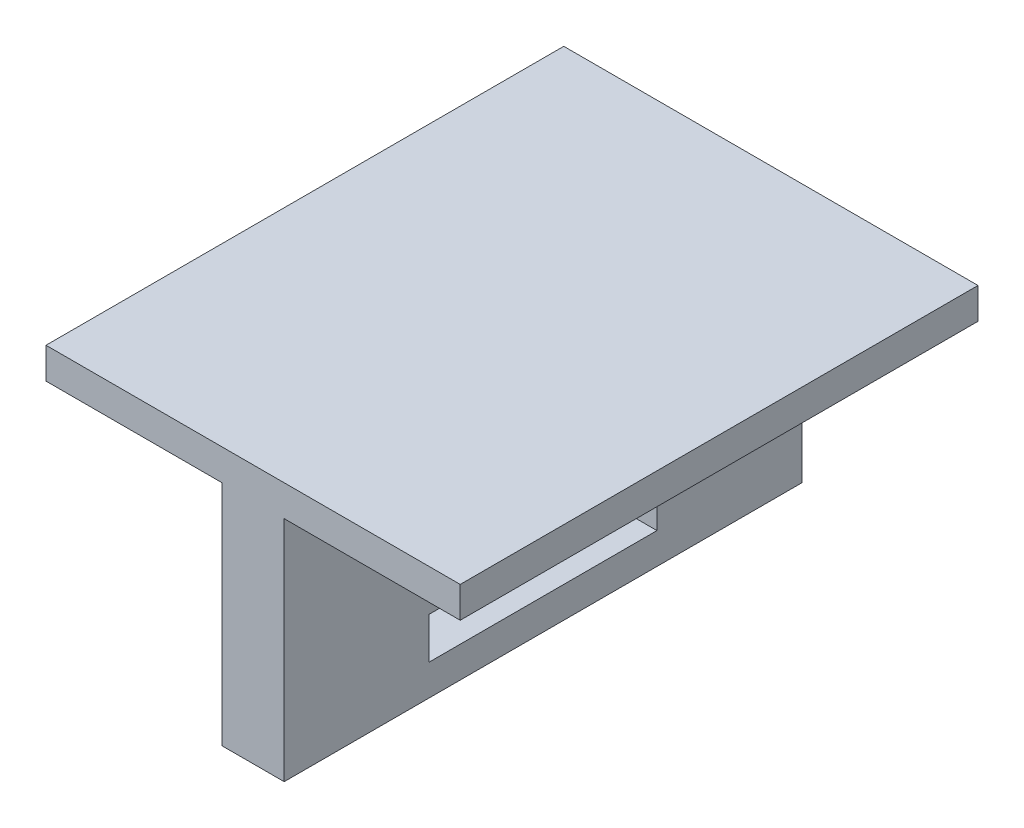
from build123d import *

# Parameters (mm, degrees)
BOSS_EXTRUDE2_DEPTH      = 3
BOSS_EXTRUDE2_DEPTH_BACK = 3
SKETCH2_W                = 50
SKETCH2_H                = 22
SKETCH2_W_2              = 22
SKETCH2_H_2              = 4
BOSS_EXTRUDE3_DEPTH      = 20
BOSS_EXTRUDE3_DEPTH_BACK = 20
SKETCH2_3_W              = 50
SKETCH2_3_H              = 3


with BuildPart() as part:
    # Sketch2 → Boss-Extrude2 (new, two sides: drawn at the far end of the back side and taken through both)
    with BuildSketch(Plane(origin=(0, 0, 0), x_dir=(0, 0, -1), z_dir=(1, 0, 0)).offset(-BOSS_EXTRUDE2_DEPTH_BACK)):
        with Locations((0, -1.5)):
            Rectangle(SKETCH2_W, SKETCH2_H)
        with Locations((0, -7.5)):
            Rectangle(SKETCH2_W_2, SKETCH2_H_2, mode=Mode.SUBTRACT)
    extrude(amount=BOSS_EXTRUDE2_DEPTH + BOSS_EXTRUDE2_DEPTH_BACK)

    # Sketch2<3> → Boss-Extrude3 (add, two sides: drawn at the far end of the back side and taken through both)
    with BuildSketch(Plane(origin=(0, 0, 0), x_dir=(0, 0, -1), z_dir=(1, 0, 0)).offset(-BOSS_EXTRUDE3_DEPTH_BACK)):
        with Locations((0, 11)):
            Rectangle(SKETCH2_3_W, SKETCH2_3_H)
    extrude(amount=BOSS_EXTRUDE3_DEPTH + BOSS_EXTRUDE3_DEPTH_BACK)


solid = part.part
